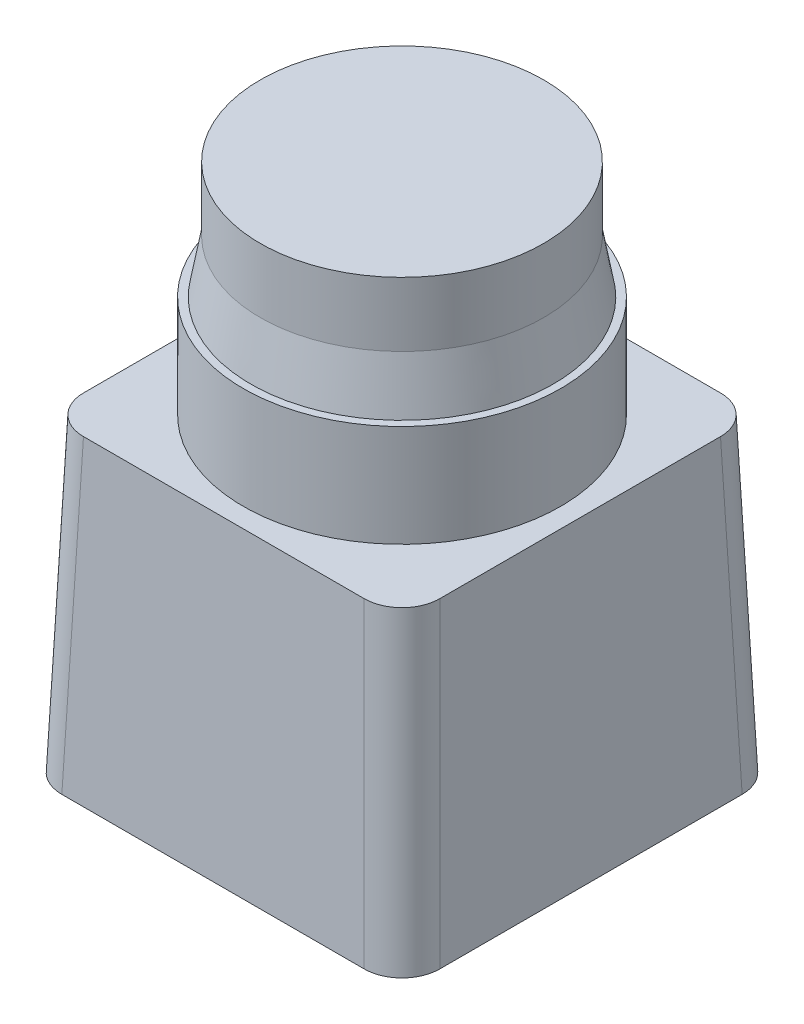
from build123d import *

# Parameters (mm, degrees)
ESBO_O1_W                 = 50
ESBO_O1_H                 = 50
RESSALTO_EXTRUS_O1_DEPTH  = 41
RESSALTO_EXTRUS_O1_TAPER  = 2
FILETE1_R                 = 5
ESBO_O3_R                 = 1.25
CORTE_EXTRUS_O1_DEPTH     = 6
REVOLU_O2_ANGLE           = 10
REVOLU_O2_OTHER_WAY_ANGLE = 10
CORTE_EXTRUS_O2_DEPTH     = 5


with BuildPart() as part:
    # Esboço1 → Ressalto-extrusão1 (new body)
    with BuildSketch(Plane(origin=(0, 0, 0), x_dir=(1, 0, 0), z_dir=(0, 1, 0))):
        Rectangle(ESBO_O1_W, ESBO_O1_H)
    extrude(amount=RESSALTO_EXTRUS_O1_DEPTH, taper=RESSALTO_EXTRUS_O1_TAPER)

    # Esboço2 → Revolução1 (revolve)
    with BuildSketch(Plane(origin=(0, 0, 0), x_dir=(0, 0, -1), z_dir=(1, 0, 0))):
        Polygon((0, 41), (0, 70), (18.75, 70), (18.75, 61.5), (20, 54.5), (21, 54.5), (21, 41), align=None)
    revolve(axis=Axis((0, 41, 0), (0, 1, 0)))

    # Filete1
    filete1_edges = [part.edges().sort_by_distance(p)[0] for p in [
        (24.284124225, 20.5, 24.284124225),
        (-24.284124225, 20.5, 24.284124225),
        (-24.284124225, 20.5, -24.284124225),
        (24.284124225, 20.5, -24.284124225),
    ]]
    fillet(filete1_edges, radius=FILETE1_R)

    # Esboço3 → Corte-extrusão1 (cut)
    with BuildSketch(Plane(origin=(0, 0, 0), x_dir=(-1, 0, 0), z_dir=(0, -1, 0))):
        with Locations(Location((20, 20.625, 0), (0, 0, 90))):
            Circle(ESBO_O3_R)
        with Locations(Location((-20, -19.375, 0), (0, 0, 90))):
            Circle(ESBO_O3_R)
    extrude(amount=-CORTE_EXTRUS_O1_DEPTH, mode=Mode.SUBTRACT)

    # Esboço5 → Revolução2 (revolve)
    with BuildSketch(Plane(origin=(0, 0, 0), x_dir=(0, 0, -1), z_dir=(1, 0, 0))):
        Polygon((19.017857143, 60), (22, 60), (22, 41), (21, 41), (21, 54.5), (20, 54.5), align=None)
    revolve(axis=Axis((0, 41, 0), (0, -1, 0)), revolution_arc=REVOLU_O2_ANGLE)

    # Esboço5 → Revolução2 other way (revolve)
    with BuildSketch(Plane(origin=(0, 0, 0), x_dir=(0, 0, -1), z_dir=(1, 0, 0))):
        Polygon((19.017857143, 60), (22, 60), (22, 41), (21, 41), (21, 54.5), (20, 54.5), align=None)
    revolve(axis=Axis((0, 41, 0), (0, 1, 0)), revolution_arc=REVOLU_O2_OTHER_WAY_ANGLE)

    # Esboço7 → Corte-extrusão2 (cut)
    with BuildSketch(Plane(origin=(-25, 0, 0), x_dir=(0, 0, -1), z_dir=(1, 0, 0))):
        with BuildLine():
            Line((-16.1, 8.9), (-11.1, 8.9))
            ThreePointArc((-11.1, 8.9), (-10.392893219, 8.607106781), (-10.1, 7.9))
            Line((-10.1, 7.9), (-10.1, 5.9))
            ThreePointArc((-10.1, 5.9), (-10.392893219, 5.192893219), (-11.1, 4.9))
            Line((-11.1, 4.9), (-16.1, 4.9))
            ThreePointArc((-16.1, 4.9), (-16.807106781, 5.192893219), (-17.1, 5.9))
            Line((-17.1, 5.9), (-17.1, 7.9))
            ThreePointArc((-17.1, 7.9), (-16.807106781, 8.607106781), (-16.1, 8.9))
        make_face()
    extrude(amount=CORTE_EXTRUS_O2_DEPTH, mode=Mode.SUBTRACT)


solid = part.part
